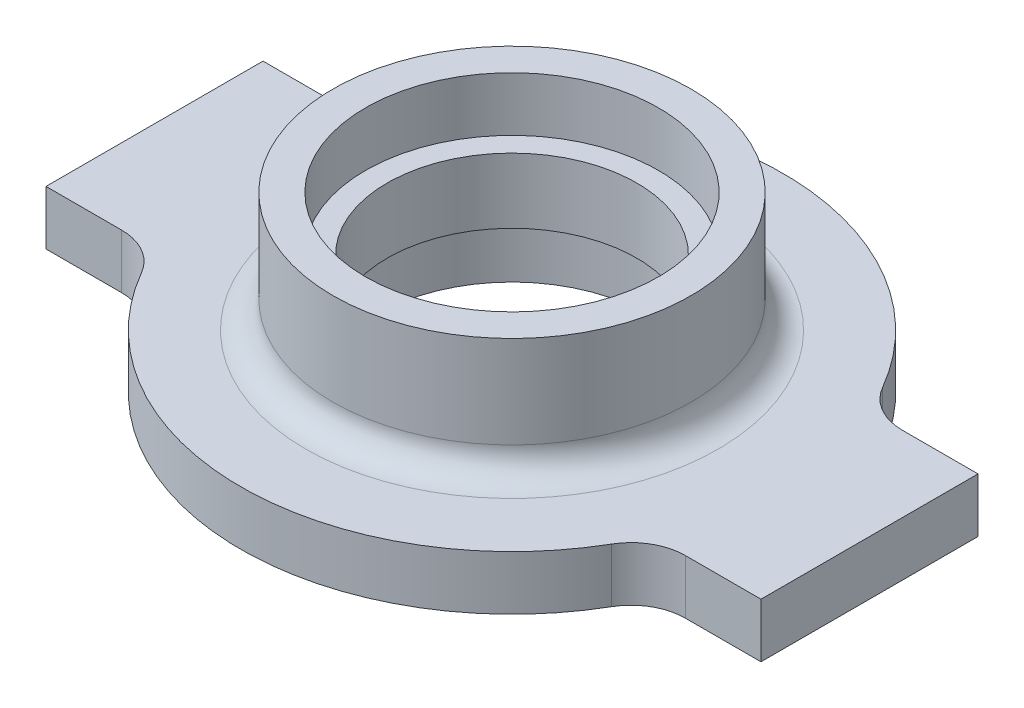
from build123d import *

# Parameters (mm, degrees)
SKETCH1_R           = 12.5
BOSS_EXTRUDE1_DEPTH = 5
SKETCH2_R           = 16.5
SKETCH2_R_2         = 11.5
BOSS_EXTRUDE2_DEPTH = 6
SKETCH3_R           = 16.5
SKETCH3_R_2         = 13.5
BOSS_EXTRUDE3_DEPTH = 5
FILLET1_R           = 2.5
FILLET2_R           = 5


with BuildPart() as part:
    # Sketch1 → Boss-Extrude1 (new body)
    with BuildSketch(Plane(origin=(0, 0, 0), x_dir=(1, 0, 0), z_dir=(0, 1, 0))):
        with BuildLine():
            Line((-22.912878475, 10), (-32.945, 10))
            Line((-32.945, 10), (-32.945, -10))
            Line((-32.945, -10), (-22.912878475, -10))
            ThreePointArc((-22.912878475, -10), (0, -25), (22.912878475, -10))
            Line((22.912878475, -10), (32.945, -10))
            Line((32.945, -10), (32.945, 10))
            Line((32.945, 10), (22.912878475, 10))
            ThreePointArc((22.912878475, 10), (0, 25), (-22.912878475, 10))
        make_face()
        with Locations(Location((0, 0, 0), (0, 0, 270))):
            Circle(SKETCH1_R, mode=Mode.SUBTRACT)
    extrude(amount=BOSS_EXTRUDE1_DEPTH)

    # Sketch2 → Boss-Extrude2 (add)
    with BuildSketch(Plane(origin=(0, 5, 0), x_dir=(1, 0, 0), z_dir=(0, 1, 0))):
        with Locations(Location((0, 0, 0), (0, 0, 270))):
            Circle(SKETCH2_R)
        with Locations(Location((0, 0, 0), (0, 0, 270))):
            Circle(SKETCH2_R_2, mode=Mode.SUBTRACT)
    extrude(amount=BOSS_EXTRUDE2_DEPTH)

    # Sketch3 → Boss-Extrude3 (add)
    with BuildSketch(Plane(origin=(0, 11, 0), x_dir=(1, 0, 0), z_dir=(0, 1, 0))):
        with Locations(Location((0, 0, 0), (0, 0, 270))):
            Circle(SKETCH3_R)
        with Locations(Location((0, 0, 0), (0, 0, 270))):
            Circle(SKETCH3_R_2, mode=Mode.SUBTRACT)
    extrude(amount=BOSS_EXTRUDE3_DEPTH)

    # Fillet1
    fillet1_edges = [part.edges().sort_by_distance(p)[0] for p in [
        (0, 5, -16.5),
    ]]
    fillet(fillet1_edges, radius=FILLET1_R)

    # Fillet2
    fillet2_edges = [part.edges().sort_by_distance(p)[0] for p in [
        (-22.912878475, 2.5, -10),
        (22.912878475, 2.5, -10),
        (22.912878475, 2.5, 10),
        (-22.912878475, 2.5, 10),
    ]]
    fillet(fillet2_edges, radius=FILLET2_R)


solid = part.part
